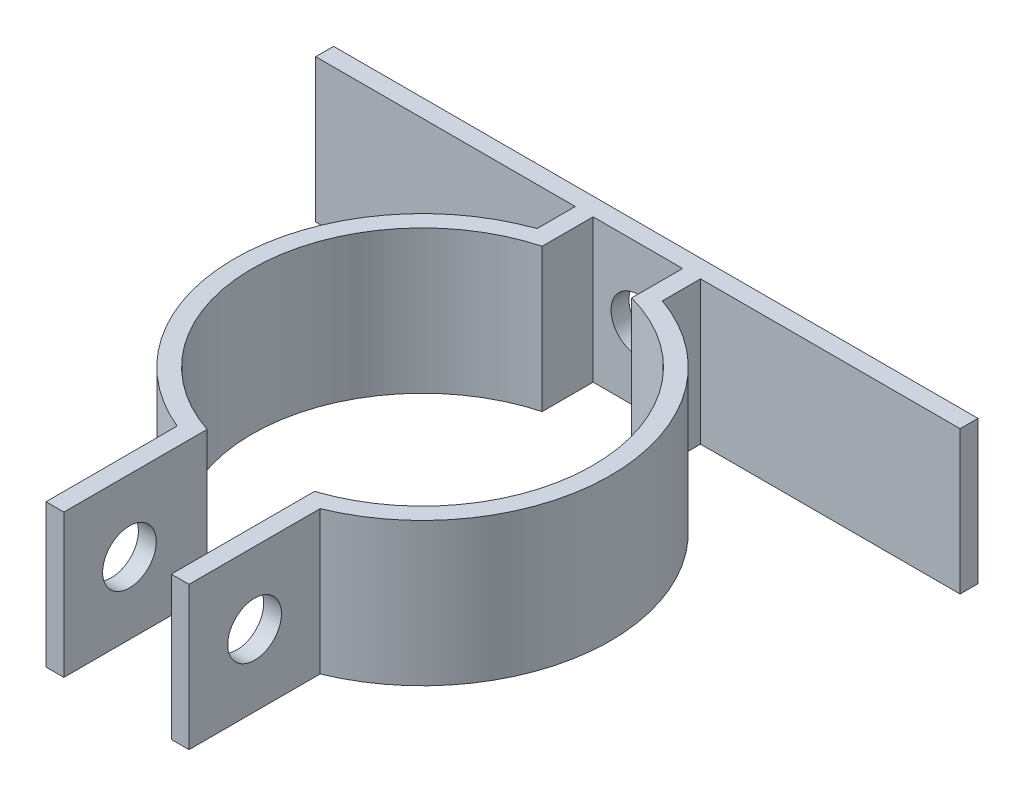
from build123d import *

# Parameters (mm, degrees)
BOSS_EXTRUDE1_DEPTH = 25.4
SKETCH2_R           = 4.7625
CUT_EXTRUDE1_DEPTH  = 25.4
SKETCH3_R           = 4.7625
CUT_EXTRUDE2_DEPTH  = 25.4


with BuildPart() as part:
    # Sketch1 → Boss-Extrude1 (new body)
    with BuildSketch(Plane(origin=(0, 0, 0), x_dir=(1, 0, 0), z_dir=(0, 1, 0))):
        with BuildLine():
            Line((0, 0), (0, 3.175))
            Line((0, 3.175), (114.3, 3.175))
            Line((114.3, 3.175), (114.3, 0))
            Line((114.3, 0), (68.2625, 0))
            Line((68.2625, 0), (68.2625, -6.774088247))
            ThreePointArc((68.2625, -6.774088247), (90.477013576, -37.368879188), (69.8246, -69.03911221))
            Line((69.8246, -69.03911221), (69.8246, -92.290964713))
            Line((69.8246, -92.290964713), (66.675, -92.290964713))
            Line((66.675, -92.290964713), (66.675, -66.890964713))
            ThreePointArc((66.675, -66.890964713), (87.364626112, -37.37586168), (65.0875, -9.03981418))
            Line((65.0875, -9.03981418), (65.0875, 0))
            Line((65.0875, 0), (49.2125, 0))
            Line((49.2125, 0), (49.2125, -9.03981418))
            ThreePointArc((49.2125, -9.03981418), (26.935373888, -37.37586168), (47.625, -66.890964713))
            Line((47.625, -66.890964713), (47.625, -92.290964713))
            Line((47.625, -92.290964713), (44.45, -92.290964713))
            Line((44.45, -92.290964713), (44.45, -69.028659115))
            ThreePointArc((44.45, -69.028659115), (23.823333687, -37.35515016), (46.0375, -6.774088247))
            Line((46.0375, -6.774088247), (46.0375, 0))
            Line((46.0375, 0), (0, 0))
        make_face()
    extrude(amount=BOSS_EXTRUDE1_DEPTH)

    # Sketch2 → Cut-Extrude1 (cut)
    with BuildSketch(Plane(origin=(69.8246, 0, 0), x_dir=(0, 0, -1), z_dir=(1, 0, 0))):
        with Locations((-80.665038461, 12.7)):
            Circle(SKETCH2_R)
    extrude(amount=-CUT_EXTRUDE1_DEPTH, mode=Mode.SUBTRACT)

    # Sketch3 → Cut-Extrude2 (cut)
    with BuildSketch(Plane(origin=(0, 0, -3.175), x_dir=(-1, 0, 0), z_dir=(0, 0, -1))):
        with Locations((-57.15, 12.7)):
            Circle(SKETCH3_R)
    extrude(amount=-CUT_EXTRUDE2_DEPTH, mode=Mode.SUBTRACT)


solid = part.part
